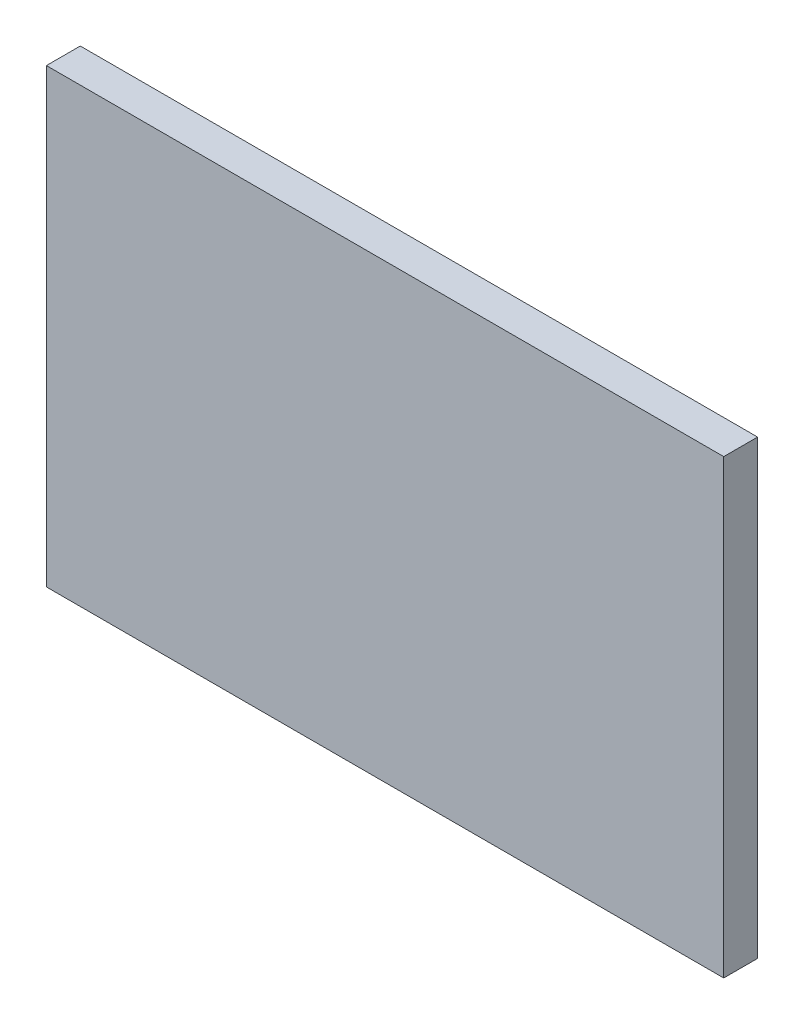
from build123d import *

# Parameters (mm, degrees)
SKETCH1_W           = 60
SKETCH1_H           = 3
BOSS_EXTRUDE1_DEPTH = 40


with BuildPart() as part:
    # Sketch1 → Boss-Extrude1 (new body)
    with BuildSketch(Plane(origin=(0, 0, 0), x_dir=(1, 0, 0), z_dir=(0, 1, 0))):
        Rectangle(SKETCH1_W, SKETCH1_H)
    extrude(amount=BOSS_EXTRUDE1_DEPTH)


solid = part.part
